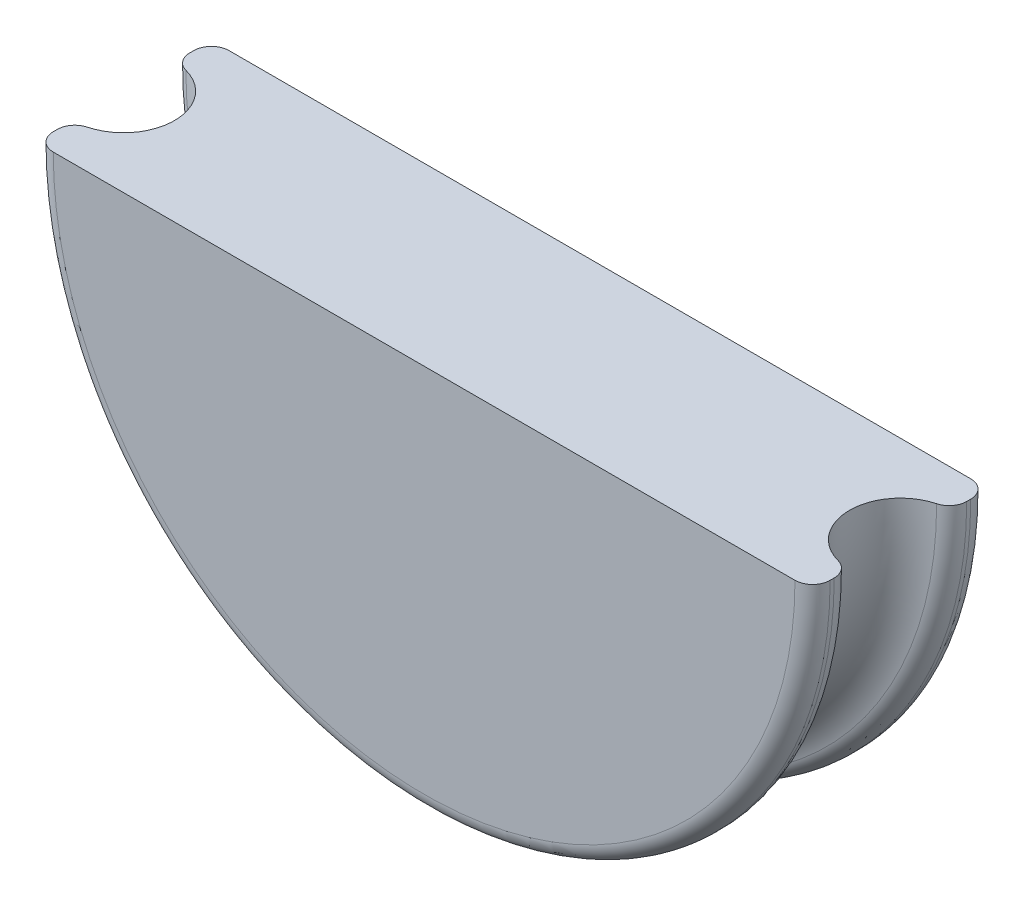
from build123d import *

# Parameters (mm, degrees)
REVOLVE1_ANGLE = 180


with BuildPart() as part:
    # Sketch1 → Revolve1 (revolve)
    with BuildSketch(Plane(origin=(0, 0, 0), x_dir=(1, 0, 0), z_dir=(0, 1, 0))):
        with BuildLine():
            Line((0, -6.35), (0, 6.35))
            Line((0, 6.35), (26.797, 6.35))
            ThreePointArc((26.797, 6.35), (27.695025612, 5.978025612), (28.067, 5.08))
            Line((28.067, 5.08), (28.067, 4.787411514))
            ThreePointArc((28.067, 4.787411514), (27.803594283, 4.013029212), (27.122641026, 3.5598701))
            ThreePointArc((27.122641026, 3.5598701), (24.384, 0), (27.122641026, -3.5598701))
            ThreePointArc((27.122641026, -3.5598701), (27.803594283, -4.013029212), (28.067, -4.787411514))
            Line((28.067, -4.787411514), (28.067, -5.08))
            ThreePointArc((28.067, -5.08), (27.695025612, -5.978025612), (26.797, -6.35))
            Line((26.797, -6.35), (0, -6.35))
        make_face()
    revolve(axis=Axis((0, 0, 6.35), (0, 0, -1)), revolution_arc=REVOLVE1_ANGLE)


solid = part.part
